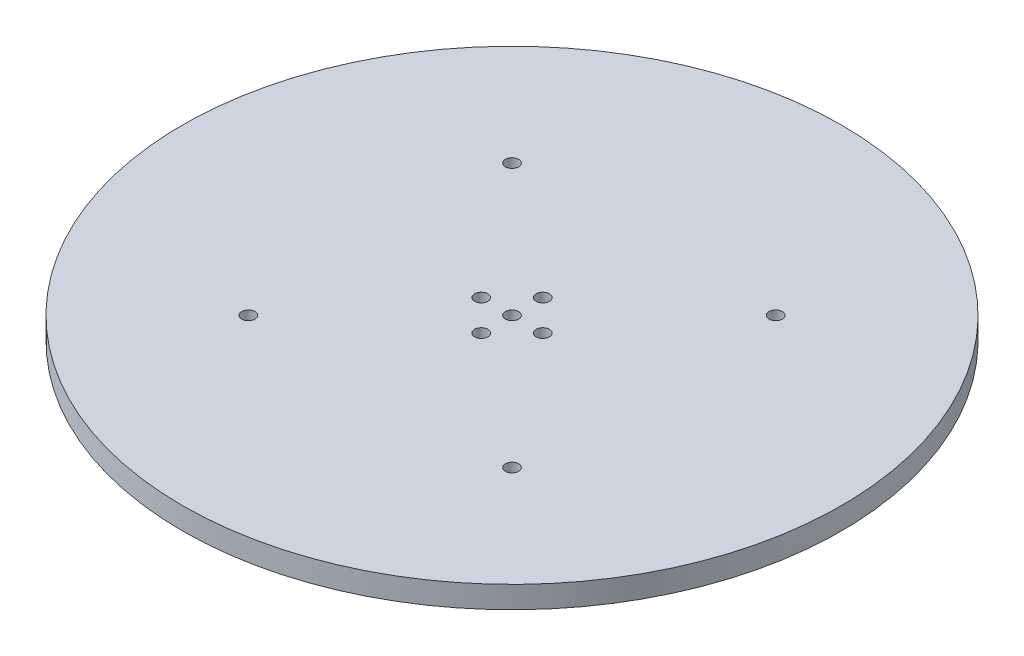
from build123d import *

# Parameters (mm, degrees)
CROQUIS1_R              = 75
SALIENTE_EXTRUIR1_DEPTH = 5
CROQUIS2_R              = 1.5
CORTAR_EXTRUIR1_DEPTH   = 5
CROQUIS3_R              = 1.5
CORTAR_EXTRUIR2_DEPTH   = 5


with BuildPart() as part:
    # Croquis1 → Saliente-Extruir1 (new body)
    with BuildSketch(Plane(origin=(0, 0, 0), x_dir=(1, 0, 0), z_dir=(0, 1, 0))):
        with Locations(Location((0, 0, 0), (0, 0, 270))):
            Circle(CROQUIS1_R)
    extrude(amount=SALIENTE_EXTRUIR1_DEPTH)

    # Croquis2 → Cortar-Extruir1 (cut)
    with BuildSketch(Plane(origin=(0, 5, 0), x_dir=(1, 0, 0), z_dir=(0, 1, 0))):
        with Locations(Location((0, 0, 0), (0, 0, 270))):
            Circle(CROQUIS2_R)
        with Locations(Location((7, 0, 0), (0, 0, 270))):
            Circle(CROQUIS2_R)
        with Locations(Location((0, -7, 0), (0, 0, 270))):
            Circle(CROQUIS2_R)
        with Locations(Location((-7, 0, 0), (0, 0, 270))):
            Circle(CROQUIS2_R)
        with Locations(Location((0, 7, 0), (0, 0, 270))):
            Circle(CROQUIS2_R)
    extrude(amount=-CORTAR_EXTRUIR1_DEPTH, mode=Mode.SUBTRACT)

    # Croquis3 → Cortar-Extruir2 (cut)
    with BuildSketch(Plane(origin=(0, 5, 0), x_dir=(1, 0, 0), z_dir=(0, 1, 0))):
        with BuildLine():
            ThreePointArc((28.5, 30), (28.939339828, 28.939339828), (30, 28.5))
            Line((30, 28.5), (30, 30))
            Line((30, 30), (28.5, 30))
        make_face()
        with BuildLine():
            Line((30, 30), (30, 28.5))
            ThreePointArc((30, 28.5), (31.060660172, 28.939339828), (31.5, 30))
            ThreePointArc((31.5, 30), (30, 31.5), (28.5, 30))
            Line((28.5, 30), (30, 30))
        make_face()
        with BuildLine():
            Line((-30, -28.5), (-30, -30))
            Line((-30, -30), (-28.5, -30))
            ThreePointArc((-28.5, -30), (-28.939339828, -28.939339828), (-30, -28.5))
        make_face()
        with BuildLine():
            Line((-28.5, -30), (-30, -30))
            Line((-30, -30), (-30, -28.5))
            ThreePointArc((-30, -28.5), (-31.060660172, -31.060660172), (-28.5, -30))
        make_face()
        with BuildLine():
            ThreePointArc((30, -28.5), (28.939339828, -28.939339828), (28.5, -30))
            Line((28.5, -30), (30, -30))
            Line((30, -30), (30, -28.5))
        make_face()
        with BuildLine():
            Line((30, -30), (28.5, -30))
            ThreePointArc((28.5, -30), (30, -31.5), (31.5, -30))
            ThreePointArc((31.5, -30), (31.060660172, -28.939339828), (30, -28.5))
            Line((30, -28.5), (30, -30))
        make_face()
        with Locations(Location((-30, 30, 0), (0, 0, 270))):
            Circle(CROQUIS3_R)
    extrude(amount=-CORTAR_EXTRUIR2_DEPTH, mode=Mode.SUBTRACT)


solid = part.part
